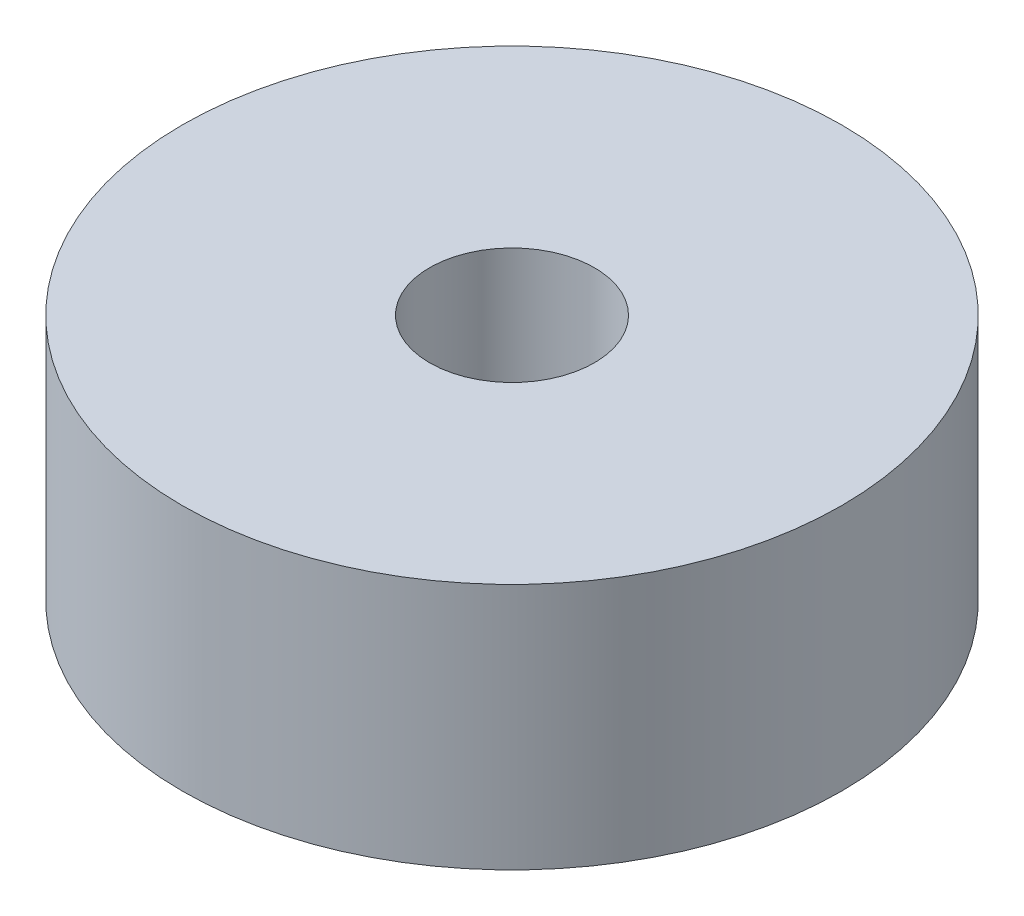
from build123d import *

# Parameters (mm, degrees)
SKETCH_1_R      = 4
SKETCH_1_R_2    = 1
EXTRUDE_1_DEPTH = 3


with BuildPart() as part:
    # 草图1 → 凸台-拉伸1 (new body)
    with BuildSketch(Plane(origin=(0, 0, 0), x_dir=(1, 0, 0), z_dir=(0, 1, 0))):
        with Locations(Location((0, 0, 0), (0, 0, 270))):
            Circle(SKETCH_1_R)
        with Locations(Location((0, 0, 0), (0, 0, 270))):
            Circle(SKETCH_1_R_2, mode=Mode.SUBTRACT)
    extrude(amount=EXTRUDE_1_DEPTH)


solid = part.part
